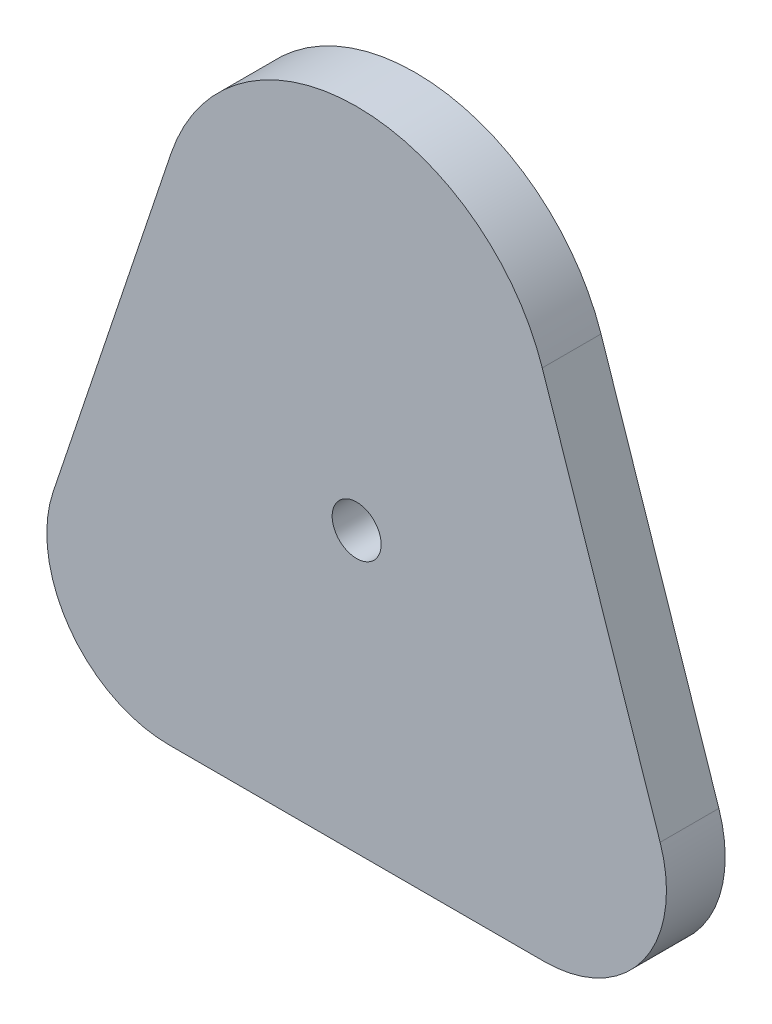
from build123d import *

# Parameters (mm, degrees)
EXTRUDE_1_DEPTH     = 6
SKETCH_3_R          = 2.5
CUT_EXTRUDE_1_DEPTH = 50.437261579


with BuildPart() as part:
    # Эскиз1 → Бобышка-Вытянуть1 (new body)
    with BuildSketch(Plane.XY):
        with BuildLine():
            ThreePointArc((18.964860111, 23.850911821), (0, 37.5), (-18.964860111, 23.850911821))
            Line((-18.964860111, 23.850911821), (-31.004148648, -12.100370354))
            ThreePointArc((-31.004148648, -12.100370354), (-29.296713539, -23.371522252), (-19.151111078, -28.569690242))
            Line((-19.151111078, -28.569690242), (19.151111078, -28.569690242))
            ThreePointArc((19.151111078, -28.569690242), (29.296713539, -23.371522252), (31.004148648, -12.100370354))
            Line((31.004148648, -12.100370354), (18.964860111, 23.850911821))
        make_face()
    extrude(amount=EXTRUDE_1_DEPTH)

    # Эскиз3 → Вырез-Вытянуть1 (cut, through all)
    with BuildSketch(Plane.XY.offset(6)):
        Circle(SKETCH_3_R)
    extrude(amount=-CUT_EXTRUDE_1_DEPTH, mode=Mode.SUBTRACT)


solid = part.part
